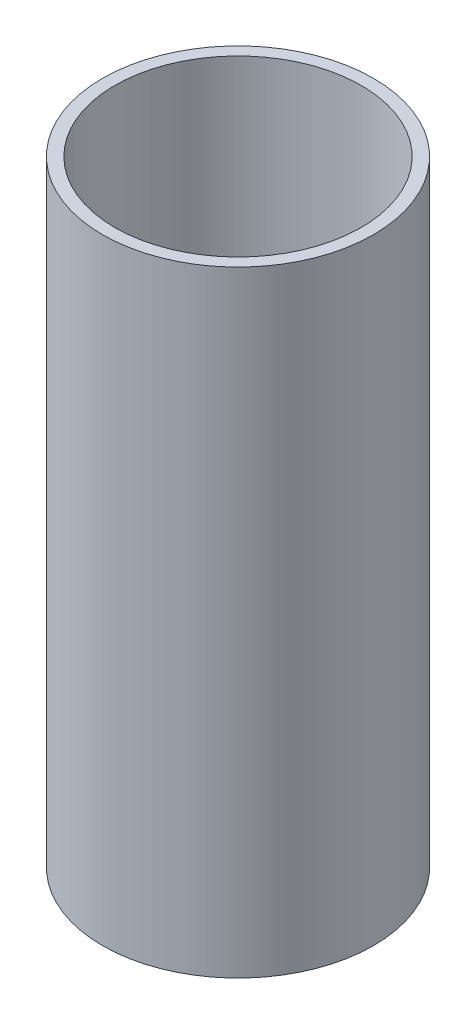
from build123d import *

# Parameters (mm, degrees)
SKETCH1_R           = 55
SKETCH1_R_2         = 50
BOSS_EXTRUDE1_DEPTH = 250


with BuildPart() as part:
    # Sketch1 → Boss-Extrude1 (new body)
    with BuildSketch(Plane(origin=(0, 0, 0), x_dir=(1, 0, 0), z_dir=(0, 1, 0))):
        with Locations(Location((0, 0, 0), (0, 0, 270))):
            Circle(SKETCH1_R)
        with Locations(Location((0, 0, 0), (0, 0, 270))):
            Circle(SKETCH1_R_2, mode=Mode.SUBTRACT)
    extrude(amount=BOSS_EXTRUDE1_DEPTH)


solid = part.part
